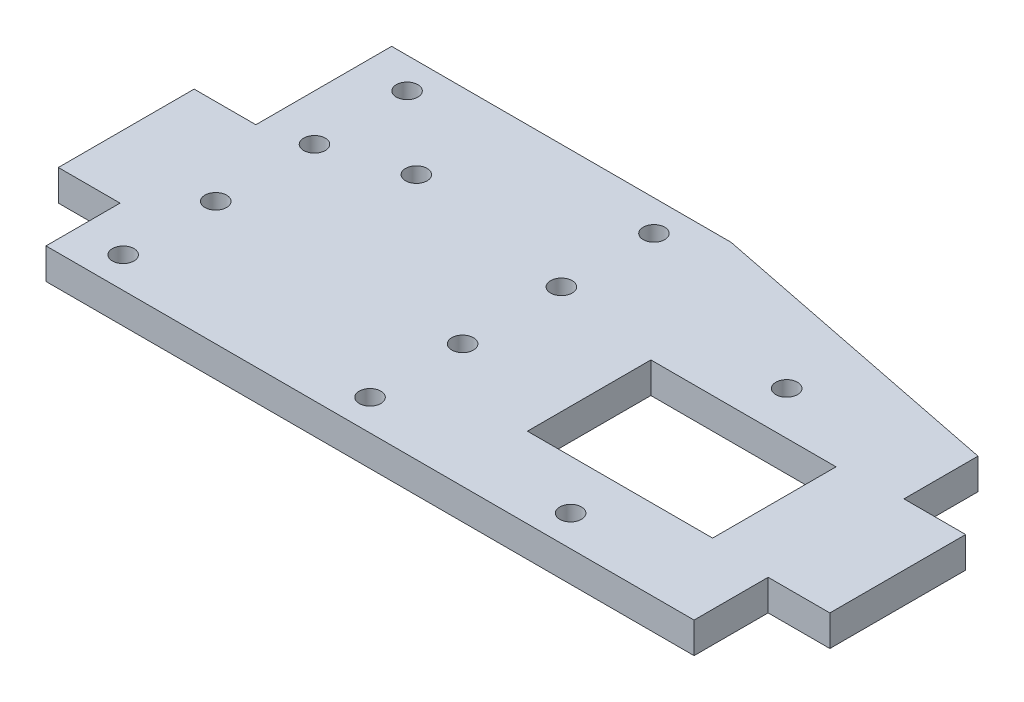
from build123d import *

# Parameters (mm, degrees)
SKETCH2_W           = 55
SKETCH2_H           = 56
SKETCH2_R           = 1.75
BOSS_EXTRUDE1_DEPTH = 5
SKETCH3_W           = 30
SKETCH3_H           = 20
BOSS_EXTRUDE2_DEPTH = 5
SKETCH5_W           = 10
SKETCH5_H           = 22
BOSS_EXTRUDE3_DEPTH = 5
SKETCH6_R           = 1.75
CUT_EXTRUDE1_DEPTH  = 5


with BuildPart() as part:
    # Sketch2 → Boss-Extrude1 (new body)
    with BuildSketch(Plane(origin=(0, 0, 0), x_dir=(1, 0, 0), z_dir=(0, 1, 0))):
        Rectangle(SKETCH2_W, SKETCH2_H)
        with Locations(Location((-20, 8, 0), (0, 0, 270))):
            Circle(SKETCH2_R, mode=Mode.SUBTRACT)
        with Locations(Location((-20, 23, 0), (0, 0, 270))):
            Circle(SKETCH2_R, mode=Mode.SUBTRACT)
        with Locations(Location((20, 8, 0), (0, 0, 90))):
            Circle(SKETCH2_R, mode=Mode.SUBTRACT)
        with Locations(Location((20, 23, 0), (0, 0, 90))):
            Circle(SKETCH2_R, mode=Mode.SUBTRACT)
        with Locations(Location((20, -8, 0), (0, 0, 270))):
            Circle(SKETCH2_R, mode=Mode.SUBTRACT)
        with Locations(Location((20, -23, 0), (0, 0, 270))):
            Circle(SKETCH2_R, mode=Mode.SUBTRACT)
        with Locations(Location((-20, -8, 0), (0, 0, 90))):
            Circle(SKETCH2_R, mode=Mode.SUBTRACT)
        with Locations(Location((-20, -23, 0), (0, 0, 90))):
            Circle(SKETCH2_R, mode=Mode.SUBTRACT)
    extrude(amount=BOSS_EXTRUDE1_DEPTH)

    # Sketch3 → Boss-Extrude2 (add)
    with BuildSketch(Plane(origin=(0, 5, 0), x_dir=(1, 0, 0), z_dir=(0, 1, 0))):
        Polygon((27.5, 28), (27.5, -28), (77.5, -28), (77.5, -16), (87.5, -16), (87.5, 6), (77.5, 6), (77.5, 18), align=None)
        with Locations((52.5, -5)):
            Rectangle(SKETCH3_W, SKETCH3_H, mode=Mode.SUBTRACT)
    extrude(amount=-BOSS_EXTRUDE2_DEPTH)

    # Sketch5 → Boss-Extrude3 (add)
    with BuildSketch(Plane(origin=(0, 5, 0), x_dir=(1, 0, 0), z_dir=(0, 1, 0))):
        with Locations((-32.5, -5)):
            Rectangle(SKETCH5_W, SKETCH5_H)
    extrude(amount=-BOSS_EXTRUDE3_DEPTH)

    # Sketch6 → Cut-Extrude1 (cut)
    with BuildSketch(Plane(origin=(0, 5, 0), x_dir=(1, 0, 0), z_dir=(0, 1, 0))):
        with Locations(Location((-7.5, 12, 0), (0, 0, 270))):
            Circle(SKETCH6_R)
        with Locations(Location((52.5, 12, 0), (0, 0, 270))):
            Circle(SKETCH6_R)
        with Locations(Location((52.5, -23, 0), (0, 0, 270))):
            Circle(SKETCH6_R)
    extrude(amount=-CUT_EXTRUDE1_DEPTH, mode=Mode.SUBTRACT)


solid = part.part
